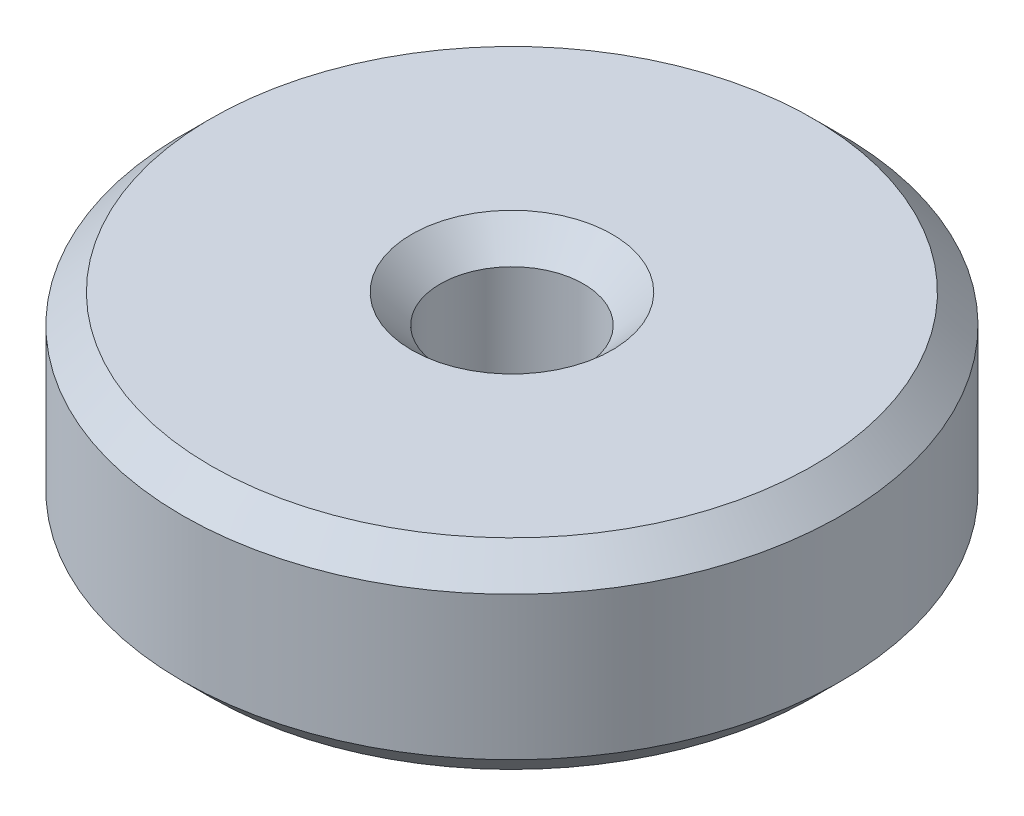
from build123d import *

# Parameters (mm, degrees)
SKETCH1_R           = 11.5
SKETCH1_R_2         = 2.5
BOSS_EXTRUDE1_DEPTH = 7
CHAMFER1_SIZE       = 1


with BuildPart() as part:
    # Sketch1 → Boss-Extrude1 (new body)
    with BuildSketch(Plane(origin=(0, 0, 0), x_dir=(1, 0, 0), z_dir=(0, 1, 0))):
        with Locations(Location((0, 0, 0), (0, 0, 270))):
            Circle(SKETCH1_R)
        with Locations(Location((0, 0, 0), (0, 0, 270))):
            Circle(SKETCH1_R_2, mode=Mode.SUBTRACT)
    extrude(amount=BOSS_EXTRUDE1_DEPTH)

    # Chamfer1
    chamfer1_edges = [part.edges().sort_by_distance(p)[0] for p in [
        (0, 0, -11.5),
        (0, 7, -11.5),
        (0, 0, -2.5),
        (0, 7, -2.5),
    ]]
    chamfer(chamfer1_edges, length=CHAMFER1_SIZE)


solid = part.part
